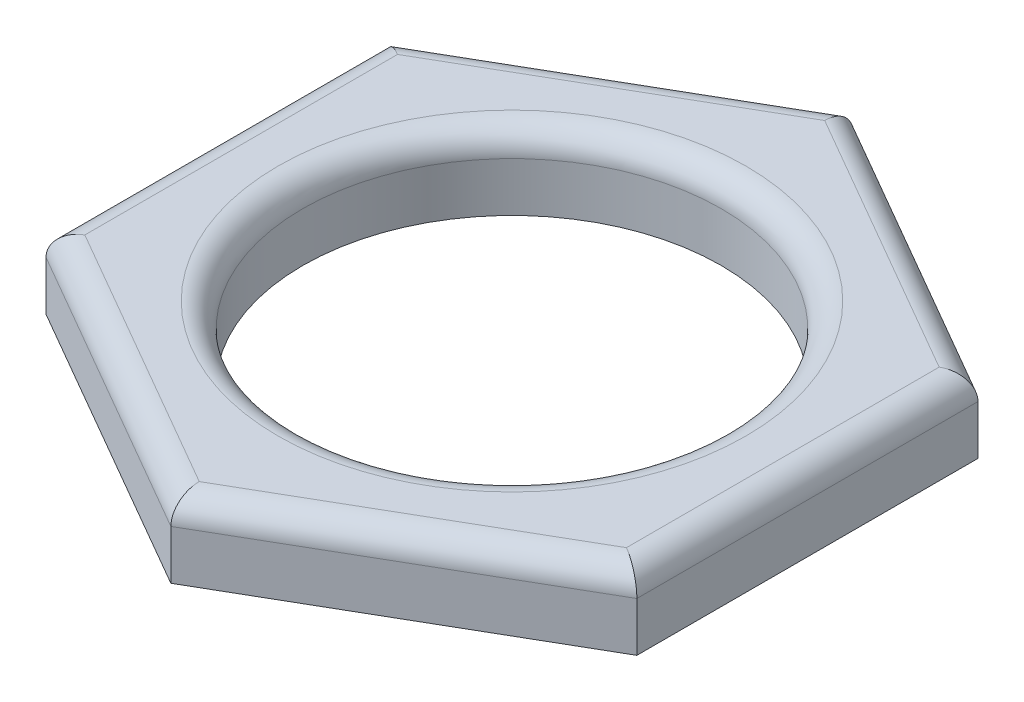
from build123d import *

# Parameters (mm, degrees)
SKETCH_1_R      = 8.5
EXTRUDE_1_DEPTH = 3
FILLET_1_R      = 1


with BuildPart() as part:
    # 草图1 → 凸台-拉伸1 (new body)
    with BuildSketch(Plane(origin=(0, 0, 0), x_dir=(1, 0, 0), z_dir=(0, 1, 0))):
        Polygon((0, 13.856406461), (-12, 6.92820323), (-12, -6.92820323), (0, -13.856406461), (12, -6.92820323), (12, 6.92820323), align=None)
        with Locations(Location((0, 0, 0), (0, 0, 270))):
            Circle(SKETCH_1_R, mode=Mode.SUBTRACT)
    extrude(amount=EXTRUDE_1_DEPTH)

    # 圆角1
    fillet_1_edges = [part.edges().sort_by_distance(p)[0] for p in [
        (-12, 3, 0),
        (-6, 3, 10.392304845),
        (6, 3, 10.392304845),
        (0, 3, -8.5),
        (12, 3, 0),
        (6, 3, -10.392304845),
        (-6, 3, -10.392304845),
    ]]
    fillet(fillet_1_edges, radius=FILLET_1_R)


solid = part.part
